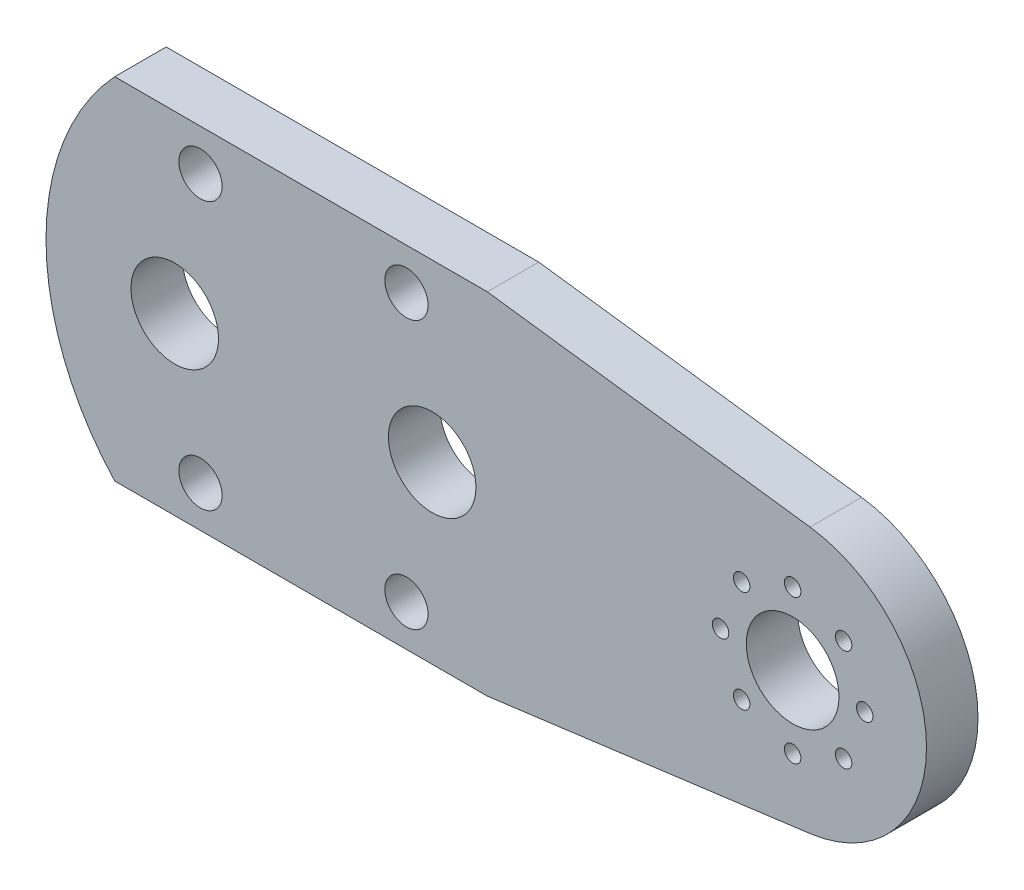
from build123d import *

# Parameters (mm, degrees)
SKETCH1_R           = 2.1
SKETCH1_R_2         = 4.25
BOSS_EXTRUDE1_DEPTH = 5


with BuildPart() as part:
    # Sketch1 → Boss-Extrude1 (new body)
    # profile 1 of 2: a face of its own
    with BuildSketch(Plane.XY):
        with BuildLine():
            Line((5.353571071, -17), (36.690694186, -12.889590884))
            ThreePointArc((36.690694186, -12.889590884), (48, 0), (36.690694186, 12.889590884))
            Line((36.690694186, 12.889590884), (5.353571071, 17))
            Line((5.353571071, 17), (-30.83030278, 17))
            ThreePointArc((-30.83030278, 17), (-37.5, 0), (-30.83030278, -17))
            Line((-30.83030278, -17), (5.353571071, -17))
        make_face()
        with Locations((-22.5, 13)):
            Circle(SKETCH1_R, mode=Mode.SUBTRACT)
        with Locations((-2.5, 13)):
            Circle(SKETCH1_R, mode=Mode.SUBTRACT)
        Circle(SKETCH1_R_2, mode=Mode.SUBTRACT)
        with Locations((-25, 0)):
            Circle(SKETCH1_R_2, mode=Mode.SUBTRACT)
        with Locations((-22.5, -13)):
            Circle(SKETCH1_R, mode=Mode.SUBTRACT)
        with Locations((-2.5, -13)):
            Circle(SKETCH1_R, mode=Mode.SUBTRACT)
        with BuildLine():
            ThreePointArc((44.5, 0), (35, 9.5), (25.5, 0))
            ThreePointArc((25.5, 0), (35, -9.5), (44.5, 0))
        make_face(mode=Mode.SUBTRACT)
    # profile 2 of 2: a face of its own
    with BuildSketch(Plane.XY):
        with BuildLine():
            ThreePointArc((25.5, 0), (35, -9.5), (44.5, 0))
            ThreePointArc((44.5, 0), (35, 9.5), (25.5, 0))
        make_face()
        with BuildLine():
            ThreePointArc((34.2, 7), (35, 6.2), (35.8, 7))
            ThreePointArc((35.8, 7), (35, 7.8), (34.2, 7))
        make_face(mode=Mode.SUBTRACT)
        with BuildLine():
            ThreePointArc((40.749747468, 4.949747468), (39.949747468, 5.749747468), (39.149747468, 4.949747468))
            ThreePointArc((39.149747468, 4.949747468), (39.949747468, 4.149747468), (40.749747468, 4.949747468))
        make_face(mode=Mode.SUBTRACT)
        with BuildLine():
            ThreePointArc((42.8, 0), (42, 0.8), (41.2, 0))
            ThreePointArc((41.2, 0), (42, -0.8), (42.8, 0))
        make_face(mode=Mode.SUBTRACT)
        with BuildLine():
            ThreePointArc((40.749747468, -4.949747468), (39.949747468, -4.149747468), (39.149747468, -4.949747468))
            ThreePointArc((39.149747468, -4.949747468), (39.949747468, -5.749747468), (40.749747468, -4.949747468))
        make_face(mode=Mode.SUBTRACT)
        with BuildLine():
            ThreePointArc((35.8, -7), (35, -6.2), (34.2, -7))
            ThreePointArc((34.2, -7), (35, -7.8), (35.8, -7))
        make_face(mode=Mode.SUBTRACT)
        with BuildLine():
            ThreePointArc((29.250252532, -4.949747468), (30.050252532, -5.749747468), (30.850252532, -4.949747468))
            ThreePointArc((30.850252532, -4.949747468), (30.050252532, -4.149747468), (29.250252532, -4.949747468))
        make_face(mode=Mode.SUBTRACT)
        with BuildLine():
            ThreePointArc((27.2, 0), (28, -0.8), (28.8, 0))
            ThreePointArc((28.8, 0), (28, 0.8), (27.2, 0))
        make_face(mode=Mode.SUBTRACT)
        with BuildLine():
            ThreePointArc((29.250252532, 4.949747468), (30.050252532, 4.149747468), (30.850252532, 4.949747468))
            ThreePointArc((30.850252532, 4.949747468), (30.050252532, 5.749747468), (29.250252532, 4.949747468))
        make_face(mode=Mode.SUBTRACT)
        with BuildLine():
            ThreePointArc((39.5, 0), (35, 4.5), (30.5, 0))
            ThreePointArc((30.5, 0), (35, -4.5), (39.5, 0))
        make_face(mode=Mode.SUBTRACT)
    extrude(amount=BOSS_EXTRUDE1_DEPTH)


solid = part.part
